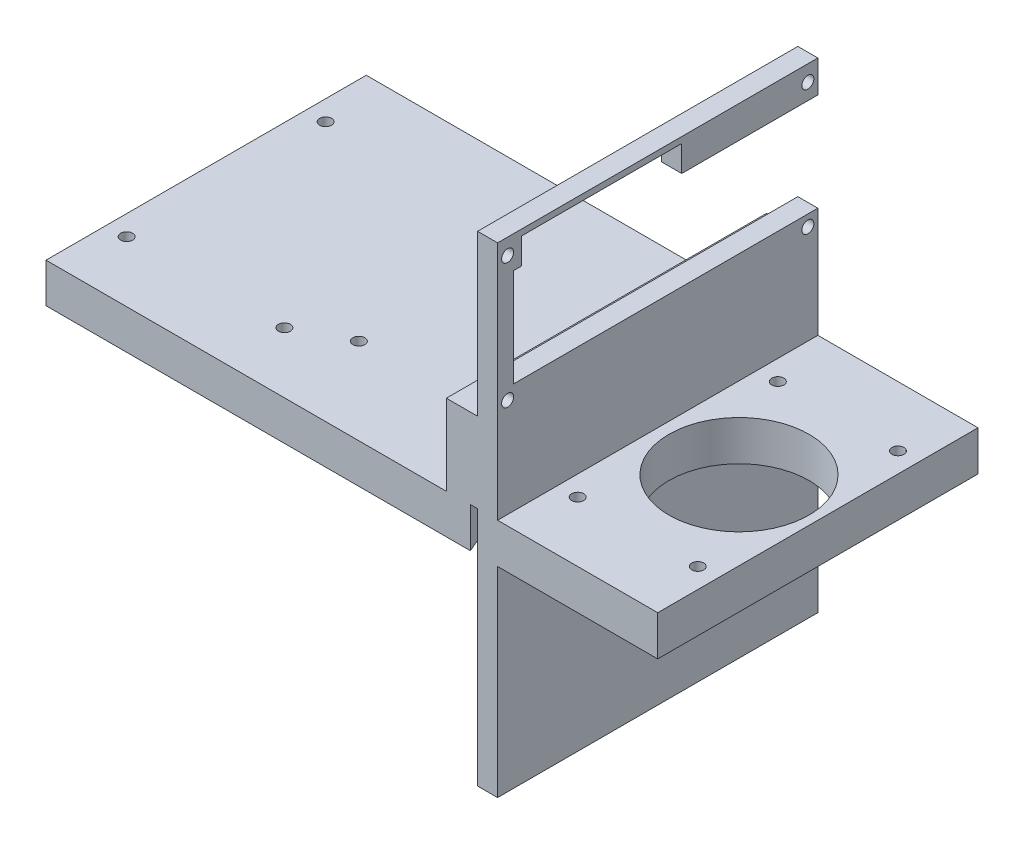
from build123d import *

# Parameters (mm, degrees)
BOSS_EXTRUDE1_DEPTH   = 80
CORTE_EXTRUS_O1_DEPTH = 10
SKETCH3_W             = 5
SKETCH3_H             = 80
BOSS_EXTRUDE2_DEPTH   = 50
SKETCH4_W             = 80
SKETCH4_H             = 9.86245083
BOSS_EXTRUDE3_DEPTH   = 100
SKETCH5_R             = 1.5
CUT_EXTRUDE1_DEPTH    = 40
SKETCH6_W             = 5
SKETCH6_H             = 80
BOSS_EXTRUDE4_DEPTH   = 40
SKETCH7_R             = 1.5
CUT_EXTRUDE2_DEPTH    = 40
SKETCH8_W             = 80
SKETCH8_H             = 10
BOSS_EXTRUDE5_DEPTH   = 40
SKETCH9_R             = 1.5
SKETCH9_R_2           = 17.5
CUT_EXTRUDE3_DEPTH    = 40


with BuildPart() as part:
    # Sketch1 → Boss-Extrude1 (new body)
    with BuildSketch(Plane.XY):
        Polygon((0, 0), (0, 30), (12.8, 30), (12.8, 0), (7.8, 0), (7.8, 10), (6, 10), (6, 0), align=None)
    extrude(amount=BOSS_EXTRUDE1_DEPTH)

    # Esboço2 → Corte-extrusão1 (cut)
    with BuildSketch(Plane.XZ):
        with BuildLine():
            Line((6, 80), (6, 0))
            ThreePointArc((6, 0), (-2.670710227, 40), (6, 80))
        make_face()
    extrude(amount=-CORTE_EXTRUS_O1_DEPTH, mode=Mode.SUBTRACT)

    # Sketch3 → Boss-Extrude2 (add)
    with BuildSketch(Plane.XZ):
        with Locations((10.3, 40)):
            Rectangle(SKETCH3_W, SKETCH3_H)
    extrude(amount=BOSS_EXTRUDE2_DEPTH)

    # Sketch4 → Boss-Extrude3 (add)
    with BuildSketch(Plane.ZY):
        with Locations((40, 4.931225415)):
            Rectangle(SKETCH4_W, SKETCH4_H)
    extrude(amount=BOSS_EXTRUDE3_DEPTH)

    # Sketch5 → Cut-Extrude1 (cut)
    with BuildSketch(Plane(origin=(0, 9.86245083, 0), x_dir=(1, 0, 0), z_dir=(0, 1, 0))):
        with Locations(Location((-6.5, -21.55, 0), (0, 0, 270))):
            Circle(SKETCH5_R)
        with Locations(Location((-6.5, -58.45, 0), (0, 0, 270))):
            Circle(SKETCH5_R)
        with Locations(Location((-43.4, -21.55, 0), (0, 0, 270))):
            Circle(SKETCH5_R)
        with Locations(Location((-43.4, -58.45, 0), (0, 0, 270))):
            Circle(SKETCH5_R)
        with Locations(Location((-55.6, -64.85, 0), (0, 0, 270))):
            Circle(SKETCH5_R)
        with Locations(Location((-95, -64.85, 0), (0, 0, 270))):
            Circle(SKETCH5_R)
        with Locations(Location((-95, -15.15, 0), (0, 0, 270))):
            Circle(SKETCH5_R)
    extrude(amount=-CUT_EXTRUDE1_DEPTH, mode=Mode.SUBTRACT)

    # Sketch6 → Boss-Extrude4 (add)
    with BuildSketch(Plane(origin=(0, 30, 0), x_dir=(1, 0, 0), z_dir=(0, 1, 0))):
        with Locations((10.3, -40)):
            Rectangle(SKETCH6_W, SKETCH6_H)
    extrude(amount=BOSS_EXTRUDE4_DEPTH)

    # Sketch7 → Cut-Extrude2 (cut)
    with BuildSketch(Plane(origin=(12.8, 0, 0), x_dir=(0, 0, -1), z_dir=(1, 0, 0))):
        with Locations(Location((-77.5, 66, 0), (0, 0, 90))):
            Circle(SKETCH7_R)
        with Locations(Location((-2.5, 66, 0), (0, 0, 90))):
            Circle(SKETCH7_R)
        with Locations(Location((-2.5, 34.7, 0), (0, 0, 90))):
            Circle(SKETCH7_R)
        with Locations(Location((-77.5, 34.7, 0), (0, 0, 90))):
            Circle(SKETCH7_R)
        Polygon((-74, 68.5), (-74, 62), (-76, 62), (-76, 37.5), (0, 37.5), (0, 62), (-34, 62), (-34, 68.5), align=None)
    extrude(amount=-CUT_EXTRUDE2_DEPTH, mode=Mode.SUBTRACT)

    # Sketch8 → Boss-Extrude5 (add)
    with BuildSketch(Plane(origin=(12.8, 0, 0), x_dir=(0, 0, -1), z_dir=(1, 0, 0))):
        with Locations((-40, 5)):
            Rectangle(SKETCH8_W, SKETCH8_H)
    extrude(amount=BOSS_EXTRUDE5_DEPTH)

    # Sketch9 → Cut-Extrude3 (cut)
    with BuildSketch(Plane(origin=(0, 10, 0), x_dir=(1, 0, 0), z_dir=(0, 1, 0))):
        with Locations(Location((47.8, -65, 0), (0, 0, 180))):
            Circle(SKETCH9_R)
        with Locations(Location((17.8, -65, 0), (0, 0, 180))):
            Circle(SKETCH9_R)
        with Locations(Location((47.8, -15, 0), (0, 0, 180))):
            Circle(SKETCH9_R)
        with Locations(Location((17.8, -15, 0), (0, 0, 180))):
            Circle(SKETCH9_R)
        with Locations(Location((33.099545745, -40, 0), (0, 0, 180))):
            Circle(SKETCH9_R_2)
    extrude(amount=-CUT_EXTRUDE3_DEPTH, mode=Mode.SUBTRACT)


solid = part.part
